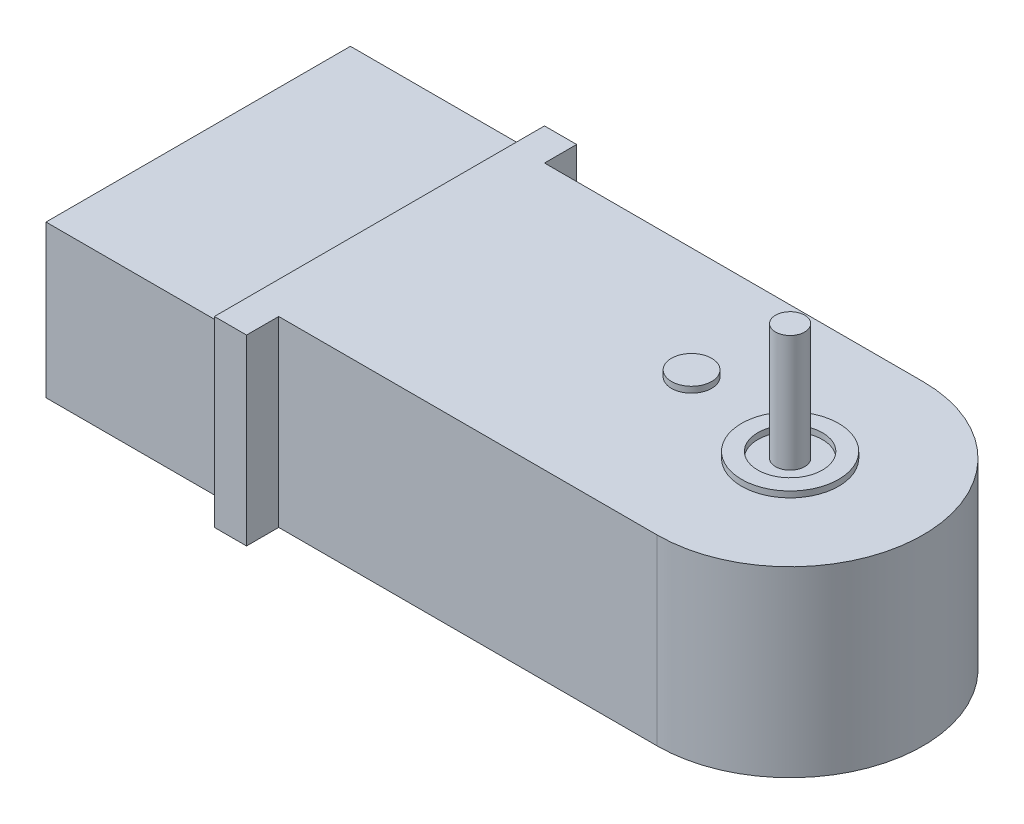
from build123d import *

# Parameters (mm, degrees)
GEAR_BOX_DEPTH      = 6.86
GEAR_BOX_DEPTH_BACK = 6.86
MOTOR_DEPTH         = 5.715
MOTOR_DEPTH_BACK    = 5.715
SKETCH2_W           = 13.61
SKETCH2_H           = 22.86
SKETCH3_R           = 1.51
SKETCH3_R_2         = 3.645
SKETCH3_R_3         = 2.43
SPACER_DEPTH        = 0.45
SPACER_BACK_START   = 0.45
SKETCH5_R           = 3.645
SKETCH5_R_2         = 2.43
SPACER_BACK_DEPTH   = 0.45
SKETCH4_R           = 1.095
OUTPUT_SHAFT_DEPTH  = 8.76


with BuildPart() as part:
    # Sketch1 → Gear Box (new, two sides: drawn at the far end of the back side and taken through both)
    with BuildSketch(Plane(origin=(0, 0, 0), x_dir=(1, 0, 0), z_dir=(0, 1, 0)).offset(-GEAR_BOX_DEPTH_BACK)):
        with BuildLine():
            Line((0, 9.98), (-28.425, 9.98))
            Line((-28.425, 9.98), (-28.425, 12.395))
            Line((-28.425, 12.395), (-30.84, 12.395))
            Line((-30.84, 12.395), (-30.84, -12.395))
            Line((-30.84, -12.395), (-28.425, -12.395))
            Line((-28.425, -12.395), (-28.425, -9.98))
            Line((-28.425, -9.98), (0, -9.98))
            ThreePointArc((0, -9.98), (9.98, 0), (0, 9.98))
        make_face()
    extrude(amount=GEAR_BOX_DEPTH + GEAR_BOX_DEPTH_BACK)

    # Sketch2 → Motor (add, two sides: drawn at the far end of the back side and taken through both)
    with BuildSketch(Plane(origin=(0, 0, 0), x_dir=(1, 0, 0), z_dir=(0, 1, 0)).offset(-MOTOR_DEPTH_BACK)):
        with Locations((-37.645, 0)):
            Rectangle(SKETCH2_W, SKETCH2_H)
    extrude(amount=MOTOR_DEPTH + MOTOR_DEPTH_BACK)

    # Sketch3 → Spacer (add)
    # profile 1 of 2: a face of its own
    with BuildSketch(Plane(origin=(0, 6.86, 0), x_dir=(1, 0, 0), z_dir=(0, 1, 0))):
        with Locations(Location((-9, 1.6, 0), (0, 0, 270))):
            Circle(SKETCH3_R)
    # profile 2 of 2: a face of its own
    with BuildSketch(Plane(origin=(0, 6.86, 0), x_dir=(1, 0, 0), z_dir=(0, 1, 0))):
        with Locations(Location((0, 0, 0), (0, 0, 270))):
            Circle(SKETCH3_R_2)
        with Locations(Location((0, 0, 0), (0, 0, 270))):
            Circle(SKETCH3_R_3, mode=Mode.SUBTRACT)
    extrude(amount=SPACER_DEPTH)

    # Sketch5 → Spacer(back) (add)
    with BuildSketch(Plane.XZ.offset(6.86).offset(SPACER_BACK_START)):
        with Locations(Location((0, 0, 0), (0, 0, 90))):
            Circle(SKETCH5_R)
        with Locations(Location((0, 0, 0), (0, 0, 90))):
            Circle(SKETCH5_R_2, mode=Mode.SUBTRACT)
    extrude(amount=-SPACER_BACK_DEPTH)

    # Sketch4 → Output Shaft (add)
    with BuildSketch(Plane(origin=(0, 6.86, 0), x_dir=(1, 0, 0), z_dir=(0, 1, 0))):
        with Locations(Location((0, 0, 0), (0, 0, 270))):
            Circle(SKETCH4_R)
    extrude(amount=OUTPUT_SHAFT_DEPTH)


solid = part.part
